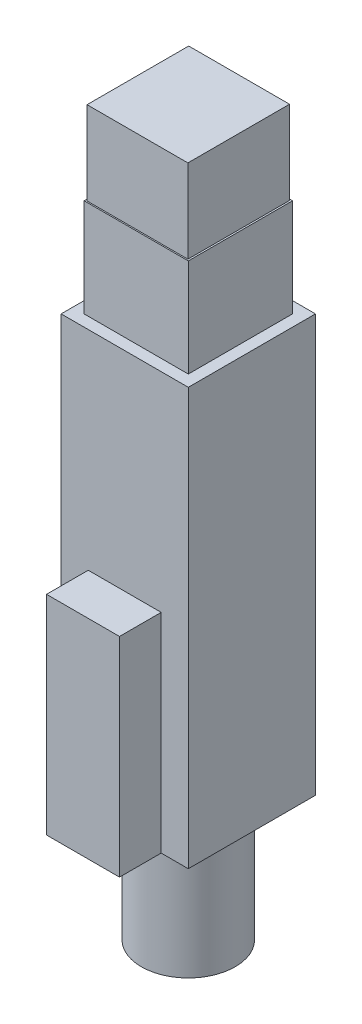
from build123d import *

# Parameters (mm, degrees)
SKETCH1_R           = 2.25
BOSS_EXTRUDE1_DEPTH = 6
SKETCH2_W           = 6.1
SKETCH2_H           = 6.1
BOSS_EXTRUDE2_DEPTH = 20
SKETCH3_W           = 5
SKETCH3_H           = 5
BOSS_EXTRUDE3_DEPTH = 8.7
SKETCH4_OUTSIDE_W   = 15.252
SKETCH4_OUTSIDE_H   = 15.252
SKETCH4_OUTSIDE_W_2 = 4.836378696
SKETCH4_OUTSIDE_H_2 = 4.876198926
CUT_EXTRUDE1_DEPTH  = 4
SKETCH5_W           = 3.5
SKETCH5_H           = 10
BOSS_EXTRUDE4_DEPTH = 2


with BuildPart() as part:
    # Sketch1 → Boss-Extrude1 (new body)
    with BuildSketch(Plane(origin=(0, 0, 0), x_dir=(1, 0, 0), z_dir=(0, 1, 0))):
        with Locations(Location((0, 0, 0), (0, 0, 270))):
            Circle(SKETCH1_R)
    extrude(amount=BOSS_EXTRUDE1_DEPTH)

    # Sketch2 → Boss-Extrude2 (add)
    with BuildSketch(Plane(origin=(0, 6, 0), x_dir=(1, 0, 0), z_dir=(0, 1, 0))):
        Rectangle(SKETCH2_W, SKETCH2_H)
    extrude(amount=BOSS_EXTRUDE2_DEPTH)

    # Sketch3 → Boss-Extrude3 (add)
    with BuildSketch(Plane(origin=(0, 26, 0), x_dir=(1, 0, 0), z_dir=(0, 1, 0))):
        Rectangle(SKETCH3_W, SKETCH3_H)
    extrude(amount=BOSS_EXTRUDE3_DEPTH)

    # Sketch4 outside → Cut-Extrude1 (cut)
    with BuildSketch(Plane(origin=(0, 34.7, 0), x_dir=(1, 0, 0), z_dir=(0, 1, 0))):
        Rectangle(SKETCH4_OUTSIDE_W, SKETCH4_OUTSIDE_H)
        Rectangle(SKETCH4_OUTSIDE_W_2, SKETCH4_OUTSIDE_H_2, mode=Mode.SUBTRACT)
    extrude(amount=-CUT_EXTRUDE1_DEPTH, mode=Mode.SUBTRACT)

    # Sketch5 → Boss-Extrude4 (add)
    with BuildSketch(Plane.XY.offset(3.05)):
        with Locations((0, 11)):
            Rectangle(SKETCH5_W, SKETCH5_H)
    extrude(amount=BOSS_EXTRUDE4_DEPTH)


solid = part.part
